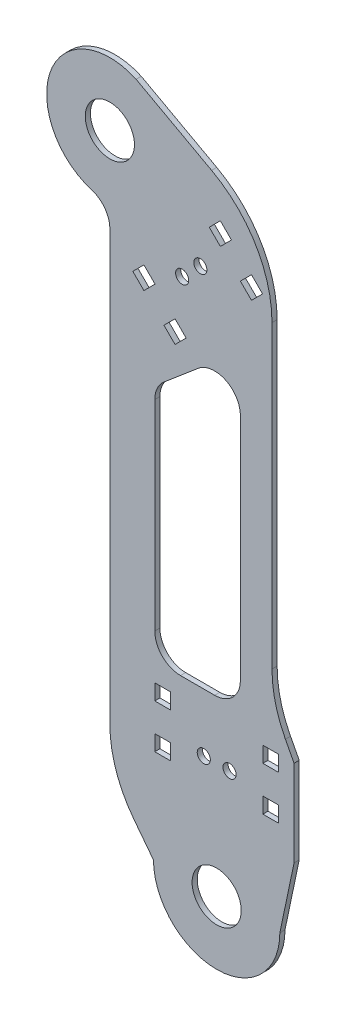
from build123d import *

# Parameters (mm, degrees)
SKETCH_1_W      = 6.1
SKETCH_1_H      = 6.1
SKETCH_1_R      = 9.55
SKETCH_1_R_2    = 2.55
EXTRUDE_2_DEPTH = 2
FILLET_1_R      = 45
FILLET_2_R      = 10


with BuildPart() as part:
    # 草图1 → 凸台-拉伸2 (new body)
    with BuildSketch(Plane.XY):
        with BuildLine():
            Line((-10.195923298, 166.045688989), (-10.195923298, 93.338899377))
            Line((-10.195923298, 93.338899377), (-10.195923298, -3.112918115))
            Line((-10.195923298, -3.112918115), (6.754076702, -25.161100623))
            ThreePointArc((6.754076702, -25.161100623), (31.304076702, -49.711100623), (55.854076702, -25.161100623))
            Line((55.854076702, -25.161100623), (61.387071712, 1.202006387))
            Line((61.387071712, 1.202006387), (61.387071712, 34.710258927))
            Line((61.387071712, 34.710258927), (52.804076702, 50.954174352))
            Line((52.804076702, 50.954174352), (52.804076702, 93.338899377))
            Line((52.804076702, 93.338899377), (52.804076702, 205.407441872))
            Line((52.804076702, 205.407441872), (0, 234.171513377))
            ThreePointArc((0, 234.171513377), (-34.1851727, 217.056026281), (-10.195923298, 187.288899377))
            Line((-10.195923298, 187.288899377), (-10.195923298, 166.045688989))
        make_face()
        with Locations((10.304076702, 14.560258927)):
            Rectangle(SKETCH_1_W, SKETCH_1_H, mode=Mode.SUBTRACT)
        with Locations((10.304076702, 31.660258927)):
            Rectangle(SKETCH_1_W, SKETCH_1_H, mode=Mode.SUBTRACT)
        with Locations((31.304076702, -25.161100623)):
            Circle(SKETCH_1_R, mode=Mode.SUBTRACT)
        with Locations((26.304076702, 19.560258927)):
            Circle(SKETCH_1_R_2, mode=Mode.SUBTRACT)
        with Locations((36.304076702, 19.560258927)):
            Circle(SKETCH_1_R_2, mode=Mode.SUBTRACT)
        with Locations((52.304076702, 14.560258927)):
            Rectangle(SKETCH_1_W, SKETCH_1_H, mode=Mode.SUBTRACT)
        with Locations((52.304076702, 31.660258927)):
            Rectangle(SKETCH_1_W, SKETCH_1_H, mode=Mode.SUBTRACT)
        Polygon((7.355428358, 168.902414276), (3.042076993, 164.589062911), (-1.271274372, 168.902414276), (3.042076993, 173.215765641), align=None, mode=Mode.SUBTRACT)
        with Locations((-10.195923298, 211.838899377)):
            Circle(SKETCH_1_R, mode=Mode.SUBTRACT)
        Polygon((40.518736396, 42.143243143), (7.254076702, 42.143243143), (7.254076702, 134.668841545), (40.518736396, 162.856651297), align=None, mode=Mode.SUBTRACT)
        Polygon((19.446954316, 156.810888318), (15.133602951, 152.497536952), (10.820251586, 156.810888318), (15.133602951, 161.124239683), align=None, mode=Mode.SUBTRACT)
        with Locations((17.891319398, 176.680588869)):
            Circle(SKETCH_1_R_2, mode=Mode.SUBTRACT)
        with Locations((24.96238721, 183.751656681)):
            Circle(SKETCH_1_R_2, mode=Mode.SUBTRACT)
        Polygon((32.740561803, 202.914250451), (37.053913168, 198.600899086), (32.740561803, 194.28754772), (28.427210437, 198.600899086), align=None, mode=Mode.SUBTRACT)
        Polygon((49.145439126, 186.509373127), (44.832087761, 182.196021762), (40.518736396, 186.509373127), (44.832087761, 190.822724493), align=None, mode=Mode.SUBTRACT)
    extrude(amount=EXTRUDE_2_DEPTH)

    # 圆角1
    fillet_1_edges = [part.edges().sort_by_distance(p)[0] for p in [
        (52.804076702, 205.407441872, 1),
        (52.804076702, 50.954174352, 1),
        (-10.195923298, -3.112918115, 1),
    ]]
    fillet(fillet_1_edges, radius=FILLET_1_R)

    # 圆角2
    fillet_2_edges = [part.edges().sort_by_distance(p)[0] for p in [
        (40.518736396, 162.856651297, 1),
        (7.254076702, 134.668841545, 1),
        (7.254076702, 42.143243143, 1),
        (40.518736396, 42.143243143, 1),
        (-10.195923298, 187.288899377, 1),
    ]]
    fillet(fillet_2_edges, radius=FILLET_2_R)


solid = part.part
